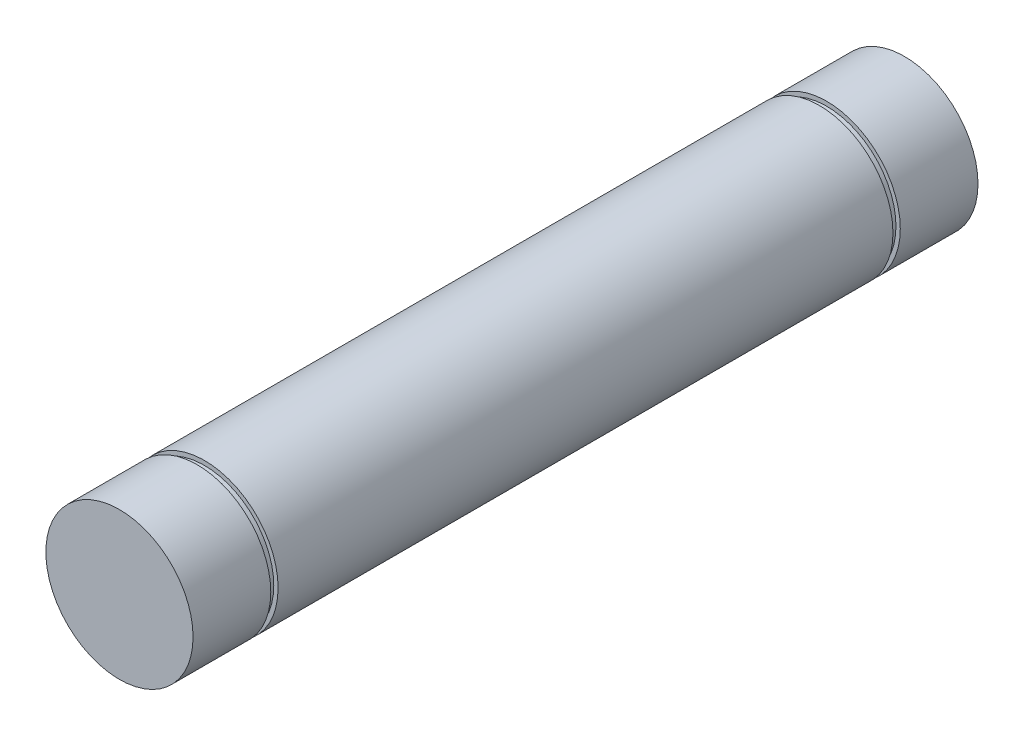
from build123d import *

# Parameters (mm, degrees)
SKETCH1_R           = 14.29004
BOSS_EXTRUDE1_DEPTH = 76.2
SKETCH2_W           = 1.4224
SKETCH2_H           = 0.84074


with BuildPart() as part:
    # Sketch1 → Boss-Extrude1 (new, symmetric)
    with BuildSketch(Plane.XY):
        Circle(SKETCH1_R)
    extrude(amount=BOSS_EXTRUDE1_DEPTH, both=True)

    # Sketch2 → Cut-Revolve1 (revolve, cut)
    with BuildSketch(Plane(origin=(0, 0, 0), x_dir=(0, 0, -1), z_dir=(1, 0, 0)), mode=Mode.PRIVATE) as cut_revolve1_sk:
        with Locations((-60.4012, 13.86967)):
            Rectangle(SKETCH2_W, SKETCH2_H)
    cut_revolve1 = revolve(cut_revolve1_sk.sketch.rotate(Axis((0, 0, 76.2), (0, 0, -1)), 90), axis=Axis((0, 0, 76.2), (0, 0, -1)), mode=Mode.SUBTRACT)

    # Mirror1: Cut-Revolve1 across plane
    add(cut_revolve1.mirror(Plane.XY), mode=Mode.SUBTRACT)


solid = part.part
